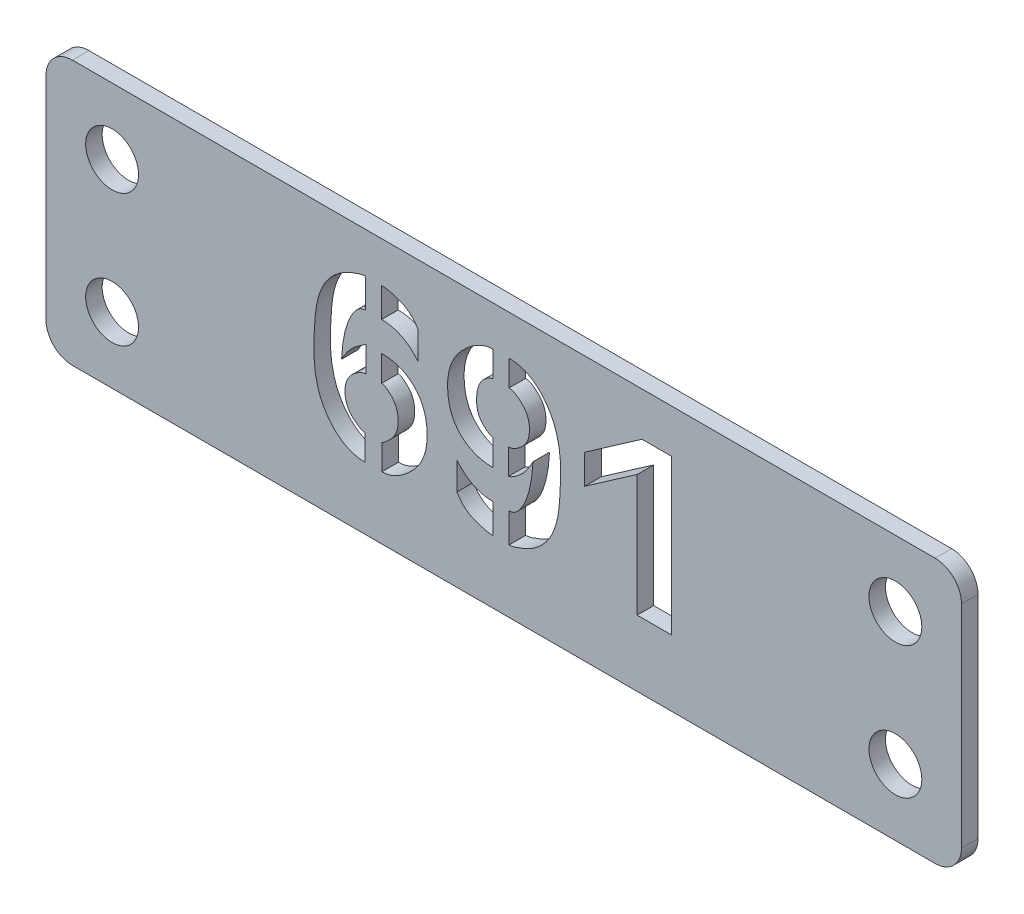
from build123d import *

# Parameters (mm, degrees)
SKETCH1_W           = 87.95004
SKETCH1_H           = 25.4
BOSS_EXTRUDE1_DEPTH = 1.5875
FILLET1_R           = 2.54
SKETCH2_R           = 2.54
CUT_EXTRUDE1_DEPTH  = 2.54
CUT_EXTRUDE2_DEPTH  = 2.54


with BuildPart() as part:
    # Sketch1 → Boss-Extrude1 (new body)
    with BuildSketch(Plane.XY):
        with Locations((-43.97502, 12.7)):
            Rectangle(SKETCH1_W, SKETCH1_H)
    extrude(amount=BOSS_EXTRUDE1_DEPTH)

    # Fillet1
    fillet1_edges = [part.edges().sort_by_distance(p)[0] for p in [
        (0, 0, 0.79375),
        (-87.95004, 0, 0.79375),
        (-87.95004, 25.4, 0.79375),
        (0, 25.4, 0.79375),
    ]]
    fillet(fillet1_edges, radius=FILLET1_R)

    # Sketch2 → Cut-Extrude1 (cut)
    with BuildSketch(Plane.XY.offset(1.5875)):
        with Locations((-81.60004, 19.05)):
            Circle(SKETCH2_R)
        with Locations((-81.60004, 6.35)):
            Circle(SKETCH2_R)
        with Locations((-6.35, 19.05)):
            Circle(SKETCH2_R)
        with Locations((-6.35, 6.35)):
            Circle(SKETCH2_R)
    extrude(amount=-CUT_EXTRUDE1_DEPTH, mode=Mode.SUBTRACT)

    # Sketch4 → Cut-Extrude2 (cut)
    with BuildSketch(Plane.XY.offset(1.5875)):
        with BuildLine():
            add(Edge.make_bspline(
                [(-55.699699688, 18.674457031), (-55.53493294, 18.669656693), (-55.209983722, 18.660189575), (-54.732814797, 18.580306443), (-54.274165116, 18.450738844), (-53.832340648, 18.268695893), (-53.403942671, 18.031191272), (-52.993168225, 17.725918526), (-52.591601689, 17.362229839), (-52.34858237, 17.081039648), (-52.223570781, 16.936392578)],
                knots=[0, 0, 0, 0, 0.981589237, 1.935867881, 2.874883326, 3.817193382, 4.778009358, 5.786515652, 6.86136133, 8, 8, 8, 8], degree=3))
            Line((-52.223570781, 16.936392578), (-52.223570781, 19.612818359))
            add(Edge.make_bspline(
                [(-52.223570781, 19.612818359), (-52.278151636, 19.700734095), (-52.386149226, 19.874690467), (-52.568712135, 20.117232517), (-52.772725397, 20.331879114), (-52.97931924, 20.535510444), (-53.208822964, 20.709400266), (-53.449871809, 20.864454926), (-53.705548986, 20.997797903), (-54.055341165, 21.136460418), (-54.472080766, 21.277277144), (-54.933452543, 21.405336292), (-55.335744385, 21.486294875), (-55.585477869, 21.499585338), (-55.699699688, 21.505664062)],
                knots=[0, 0, 0, 0, 0.90278196, 1.786309056, 2.642480722, 3.484980933, 4.31416784, 5.149327231, 5.984117888, 6.825364222, 8.429954301, 9.820147594, 11.002990303, 12, 12, 12, 12], degree=3))
            Line((-55.699699688, 21.505664062), (-55.699699688, 18.674457031))
        make_face()
        with BuildLine():
            add(Edge.make_bspline(
                [(-55.699699688, 13.369974609), (-55.637397721, 13.360303427), (-55.491854502, 13.337710642), (-55.26891411, 13.20695491), (-55.016197388, 13.004484474), (-54.783458026, 12.791787539), (-54.597854493, 12.581928987), (-54.465190979, 12.404563427), (-54.362039563, 12.205436897), (-54.268597358, 11.995834369), (-54.202490521, 11.767753844), (-54.154042963, 11.525038649), (-54.12546483, 11.266081866), (-54.117084965, 10.996716415), (-54.123801531, 10.725697804), (-54.161080949, 10.463806828), (-54.215683582, 10.21470071), (-54.288437105, 9.976707666), (-54.38992038, 9.753602211), (-54.512182757, 9.544059328), (-54.656422465, 9.347798007), (-54.817726954, 9.168960059), (-54.983499084, 9.011033463), (-55.130954159, 8.867032188), (-55.264693999, 8.748250968), (-55.377954536, 8.646972467), (-55.479263892, 8.572959671), (-55.560454542, 8.51843939), (-55.62288812, 8.476508105), (-55.663896839, 8.470841961), (-55.680352031, 8.468568359)],
                knots=[0, 0, 0, 0, 0.84864035, 1.982503222, 3.436639188, 5.250824462, 6.241735261, 7.232538953, 8.242964425, 9.274079802, 10.338818494, 11.453137866, 12.626015645, 13.865157423, 15.104299202, 16.295225768, 17.444059308, 18.559140348, 19.661201451, 20.758146762, 21.842148025, 22.956467397, 24.017611687, 24.945010351, 25.749613388, 26.441759091, 27.004132635, 27.444590983, 27.777136126, 28, 28, 28, 28], degree=3))
            Line((-55.680352031, 8.468568359), (-55.680352031, 6.014640625))
            add(Edge.make_bspline(
                [(-55.680352031, 6.014640625), (-55.566063441, 6.018908891), (-55.333196752, 6.027605621), (-54.984550314, 6.102753848), (-54.632642107, 6.220822359), (-54.27593451, 6.383803985), (-53.915741436, 6.594002658), (-53.553398265, 6.85247371), (-53.184981037, 7.152868477), (-52.8196198, 7.496501275), (-52.472122067, 7.872107904), (-52.164940176, 8.277874664), (-51.911043078, 8.708883613), (-51.698614745, 9.160636182), (-51.53421151, 9.635102213), (-51.418247128, 10.133423631), (-51.347008838, 10.652640019), (-51.326832066, 11.185863094), (-51.3466164, 11.713776412), (-51.398980217, 12.220963475), (-51.492773136, 12.69801541), (-51.623651854, 13.144780882), (-51.796605208, 13.559784581), (-52.001775749, 13.946635721), (-52.250025189, 14.29949871), (-52.529464662, 14.623315862), (-52.843964125, 14.908299172), (-53.178879411, 15.163918944), (-53.544078478, 15.371934835), (-53.928010052, 15.549020128), (-54.339108027, 15.679878649), (-54.771621033, 15.776750107), (-55.228354804, 15.835906154), (-55.540442512, 15.842903758), (-55.699699688, 15.846474609)],
                knots=[0, 0, 0, 0, 0.750466217, 1.529099129, 2.333333938, 3.186938629, 4.101755041, 5.070001607, 6.109345241, 7.223855547, 8.363888835, 9.468774831, 10.561602582, 11.645626676, 12.744829309, 13.855212284, 15.00316355, 16.18396811, 17.357438015, 18.473044873, 19.531539208, 20.548554855, 21.527259833, 22.4818019, 23.420527851, 24.35691164, 25.28690457, 26.205287319, 27.120103732, 28.043283237, 28.979347187, 29.949421824, 30.953597721, 32, 32, 32, 32], degree=3))
            Line((-55.699699688, 15.846474609), (-55.699699688, 13.369974609))
        make_face()
        with BuildLine():
            Line((-57.282982891, 5.992068359), (-57.282982891, 8.445996094))
            add(Edge.make_bspline(
                [(-57.282982891, 8.445996094), (-57.371375873, 8.458755243), (-57.56512769, 8.486722489), (-57.855060447, 8.639402377), (-58.17379116, 8.857482734), (-58.450720009, 9.093877134), (-58.67224193, 9.317653797), (-58.8173321, 9.511428142), (-58.945202988, 9.715100875), (-59.048114503, 9.933812883), (-59.125030897, 10.167055637), (-59.184963822, 10.411509404), (-59.213981991, 10.671284515), (-59.229417967, 10.938621571), (-59.213963674, 11.205944244), (-59.185032668, 11.465760308), (-59.12478562, 11.710071715), (-59.04959051, 11.941973018), (-58.944189609, 12.156398536), (-58.817286633, 12.356144062), (-58.673049169, 12.546607139), (-58.448080633, 12.764035889), (-58.166053942, 12.997272117), (-57.829598357, 13.211495222), (-57.509235028, 13.352396668), (-57.295907211, 13.379733733), (-57.195918437, 13.392546875)],
                knots=[0, 0, 0, 0, 0.927388831, 2.032777548, 3.375484782, 4.969034164, 5.826957393, 6.660414622, 7.49265999, 8.336796255, 9.17861274, 10.055876385, 10.961446106, 11.906020874, 12.850595642, 13.756165363, 14.633429008, 15.475245493, 16.299111061, 17.121827315, 17.946381701, 18.788273118, 20.384670103, 21.762208047, 22.95112567, 24, 24, 24, 24], degree=3))
            Line((-57.195918437, 13.392546875), (-57.195918437, 15.846474609))
            add(Edge.make_bspline(
                [(-57.195918437, 15.846474609), (-57.205731837, 15.843567243), (-57.234534722, 15.835033956), (-57.28409521, 15.802121934), (-57.361084077, 15.758064239), (-57.457992092, 15.68915742), (-57.582267148, 15.605351346), (-57.729916431, 15.502646972), (-57.900441155, 15.379572306), (-58.163760379, 15.189564882), (-58.50302387, 14.904880698), (-58.884433638, 14.488084732), (-59.23961156, 13.993363718), (-59.447928851, 13.627880618), (-59.5563325, 13.437691406)],
                knots=[0, 0, 0, 0, 0.107227588, 0.314719051, 0.619055722, 1.042269004, 1.562688087, 2.196047321, 2.93315846, 3.77413392, 5.610653111, 7.578375929, 9.699085951, 12, 12, 12, 12], degree=3))
            add(Edge.make_bspline(
                [(-59.5563325, 13.437691406), (-59.546089395, 13.628059216), (-59.526035721, 14.000756173), (-59.470026814, 14.544869768), (-59.399593473, 15.061186663), (-59.314231526, 15.549189574), (-59.206318089, 16.008123093), (-59.086219709, 16.440878202), (-58.942616881, 16.844859128), (-58.788075557, 17.219766348), (-58.617387176, 17.555683816), (-58.444175891, 17.853243139), (-58.262114021, 18.104536217), (-58.074128106, 18.310403637), (-57.882360469, 18.47430684), (-57.680734239, 18.587761744), (-57.472853259, 18.661451313), (-57.330854173, 18.670144484), (-57.260410625, 18.674457031)],
                knots=[0, 0, 0, 0, 1.499814804, 2.936296909, 4.302182762, 5.59947636, 6.832403556, 8.010357135, 9.131089549, 10.20385637, 11.198577165, 12.09348467, 12.910514558, 13.634730622, 14.283349854, 14.885477346, 15.447102571, 16, 16, 16, 16], degree=3))
            Line((-57.260410625, 18.674457031), (-57.237838359, 21.505664062))
            add(Edge.make_bspline(
                [(-57.237838359, 21.505664062), (-57.281985901, 21.504429036), (-57.377239047, 21.501764331), (-57.529180973, 21.476851836), (-57.700384968, 21.438090506), (-57.890948797, 21.38097637), (-58.102762101, 21.315336906), (-58.333178095, 21.229082276), (-58.583110973, 21.130311572), (-58.939198352, 20.97625848), (-59.382850544, 20.752250743), (-59.884237997, 20.423254749), (-60.336544022, 20.027164557), (-60.752375612, 19.581794377), (-61.120098096, 19.076012804), (-61.426644481, 18.504044272), (-61.680094709, 17.873357188), (-61.846867214, 17.300714633), (-61.951378243, 16.796155437), (-62.022406221, 16.363817427), (-62.078550828, 15.882665504), (-62.12646362, 15.353635044), (-62.165644875, 14.775262202), (-62.189828772, 14.148339338), (-62.20493209, 13.473250257), (-62.215319585, 12.764718145), (-62.195312778, 12.047720291), (-62.134001317, 11.351070272), (-62.01930226, 10.68976481), (-61.864748424, 10.062451827), (-61.670463688, 9.466120609), (-61.423038099, 8.907458072), (-61.136531025, 8.381312837), (-60.804504862, 7.897342173), (-60.443530069, 7.456445583), (-60.05536316, 7.070973789), (-59.647171868, 6.740994185), (-59.215865485, 6.472337731), (-58.764476752, 6.258417189), (-58.288473496, 6.112012378), (-57.793155294, 6.014330141), (-57.454350663, 5.999546129), (-57.282982891, 5.992068359)],
                knots=[0, 0, 0, 0, 0.258224805, 0.557148246, 0.898993637, 1.285243804, 1.720939094, 2.19658318, 2.72458875, 3.293713335, 4.466905185, 5.628895522, 6.792944422, 7.976997915, 9.188751248, 10.441371996, 11.764900031, 13.160426009, 13.925358936, 14.779596104, 15.723723076, 16.759701844, 17.888262126, 19.115977772, 20.431107321, 21.840277142, 23.26265396, 24.627254405, 25.929304834, 27.186498069, 28.405934197, 29.594607541, 30.757363885, 31.907200789, 33.024360023, 34.08748595, 35.103329479, 36.089543733, 37.054830995, 38.01777866, 38.997390164, 40, 40, 40, 40], degree=3))
        make_face()
        with BuildLine():
            Line((-45.000445781, 6.037212891), (-45.000445781, 8.868419922))
            add(Edge.make_bspline(
                [(-45.000445781, 8.868419922), (-45.165209732, 8.873225378), (-45.490153433, 8.882702589), (-45.967362638, 8.962512027), (-46.425862338, 9.092354027), (-46.868739038, 9.273564263), (-47.295367579, 9.515416853), (-47.706032976, 9.82004497), (-48.109579653, 10.180604339), (-48.351754662, 10.461636756), (-48.476574688, 10.606484375)],
                knots=[0, 0, 0, 0, 0.981732815, 1.936151043, 2.87530384, 3.817751729, 4.781843651, 5.79049746, 6.86119478, 8, 8, 8, 8], degree=3))
            Line((-48.476574688, 10.606484375), (-48.476574688, 7.933283203))
            add(Edge.make_bspline(
                [(-48.476574688, 7.933283203), (-48.422139653, 7.845227855), (-48.314430595, 7.670995235), (-48.129717813, 7.430414208), (-47.933311598, 7.208319511), (-47.718535624, 7.01352587), (-47.495779998, 6.831738326), (-47.253230417, 6.678606158), (-46.997135124, 6.545798023), (-46.649701507, 6.400958531), (-46.230389162, 6.267127949), (-45.769056188, 6.136712656), (-45.365401654, 6.056893121), (-45.114650057, 6.043371352), (-45.000445781, 6.037212891)],
                knots=[0, 0, 0, 0, 0.902084857, 1.784929717, 2.641056041, 3.483322918, 4.310277924, 5.144792429, 5.978938483, 6.823132329, 8.423495102, 9.812614926, 11.003760167, 12, 12, 12, 12], degree=3))
        make_face()
        with BuildLine():
            Line((-45.000445781, 11.699626953), (-45.000445781, 14.172902344))
            add(Edge.make_bspline(
                [(-45.000445781, 14.172902344), (-45.072658737, 14.194735966), (-45.232407262, 14.243036009), (-45.466011234, 14.393227656), (-45.727529412, 14.590240665), (-45.955536034, 14.795560231), (-46.136312763, 14.99222897), (-46.255082474, 15.165952023), (-46.360244027, 15.35233157), (-46.439989818, 15.559426106), (-46.50358109, 15.781847774), (-46.553721615, 16.020815296), (-46.576783008, 16.27809432), (-46.589678518, 16.632323241), (-46.566530417, 17.060193384), (-46.48559312, 17.533604554), (-46.349379753, 17.946213284), (-46.153177826, 18.295367051), (-45.909950422, 18.57848864), (-45.646368946, 18.817052618), (-45.346279194, 18.991677247), (-45.130900771, 19.063919456), (-45.023018047, 19.100105469)],
                knots=[0, 0, 0, 0, 0.715951478, 1.583818193, 2.622518131, 3.840770963, 4.500905221, 5.163023417, 5.84157773, 6.535877148, 7.271776186, 8.045216538, 8.858597215, 9.729842735, 11.422544117, 12.931550855, 14.295331202, 15.543029889, 16.72081764, 17.838634662, 18.917375397, 20, 20, 20, 20], degree=3))
            Line((-45.023018047, 19.100105469), (-45.023018047, 21.550808594))
            add(Edge.make_bspline(
                [(-45.023018047, 21.550808594), (-45.137314517, 21.546557564), (-45.370197262, 21.537895953), (-45.71871844, 21.462473741), (-46.071557977, 21.345368354), (-46.426579561, 21.177607945), (-46.78767844, 20.968414033), (-47.150868907, 20.709755189), (-47.51841194, 20.405976017), (-47.882646703, 20.059255372), (-48.232546393, 19.683588184), (-48.537260295, 19.274899339), (-48.793427459, 18.843151122), (-49.003846157, 18.389339991), (-49.169872987, 17.913355736), (-49.284633219, 17.413626525), (-49.356620625, 16.892421048), (-49.376476051, 16.358078491), (-49.356779524, 15.829102808), (-49.304383311, 15.321913135), (-49.210599107, 14.844860872), (-49.079715844, 14.398098908), (-48.906771975, 13.983082199), (-48.701569032, 13.596277979), (-48.453437454, 13.243243639), (-48.173561722, 12.920060916), (-47.860507614, 12.632584839), (-47.519776963, 12.385698786), (-47.16030034, 12.166995875), (-46.770979353, 12.000398958), (-46.362452628, 11.860418737), (-45.927863125, 11.770941958), (-45.471905579, 11.709764067), (-45.159741784, 11.703052063), (-45.000445781, 11.699626953)],
                knots=[0, 0, 0, 0, 0.749494808, 1.527119852, 2.330313653, 3.185757064, 4.099389332, 5.066382591, 6.108855094, 7.226764498, 8.365322118, 9.4744249, 10.565838086, 11.65485419, 12.752634007, 13.868448651, 15.014914, 16.201239304, 17.37319026, 18.487353069, 19.544477281, 20.560176496, 21.53761463, 22.490921131, 23.428431988, 24.363603715, 25.292392855, 26.211051014, 27.122173597, 28.047714602, 28.984774037, 29.952076108, 30.954952192, 32, 32, 32, 32], degree=3))
        make_face()
        with BuildLine():
            add(Edge.make_bspline(
                [(-43.530023906, 11.699626953), (-43.445243535, 11.73084044), (-43.26372745, 11.797668999), (-42.996532779, 11.949523705), (-42.712934434, 12.14367947), (-42.408925167, 12.382297142), (-42.096104576, 12.692877636), (-41.785291358, 13.087903), (-41.469418048, 13.56470632), (-41.27145374, 13.917788863), (-41.166385234, 14.105185547)],
                knots=[0, 0, 0, 0, 0.627367658, 1.343203847, 2.128914725, 3.017247848, 4.026746978, 5.185895718, 6.506429098, 8, 8, 8, 8], degree=3))
            add(Edge.make_bspline(
                [(-41.166385234, 14.105185547), (-41.17669007, 13.914827707), (-41.196806786, 13.543218245), (-41.251786793, 12.999875674), (-41.327208139, 12.485166156), (-41.412249305, 11.996005285), (-41.518090281, 11.535097133), (-41.643927654, 11.102590981), (-41.786258309, 10.697924295), (-41.941236482, 10.323186365), (-42.111501711, 9.987000946), (-42.285517847, 9.690780865), (-42.463589972, 9.437422326), (-42.651882101, 9.232428808), (-42.843115365, 9.069659191), (-43.042593414, 8.954296251), (-43.249931596, 8.881546249), (-43.391885818, 8.872772462), (-43.462307109, 8.868419922)],
                knots=[0, 0, 0, 0, 1.500656453, 2.929525446, 4.297356154, 5.595377752, 6.837240619, 8.018191915, 9.139553248, 10.212922072, 11.208201073, 12.103610771, 12.916135179, 13.64075765, 14.289740866, 14.884851911, 15.446792303, 16, 16, 16, 16], degree=3))
            Line((-43.462307109, 8.868419922), (-43.462307109, 6.037212891))
            add(Edge.make_bspline(
                [(-43.462307109, 6.037212891), (-43.420255419, 6.038177115), (-43.327925868, 6.040294186), (-43.18144882, 6.071497032), (-43.012073291, 6.103198055), (-42.826383697, 6.162075116), (-42.617472821, 6.227829857), (-42.391795781, 6.317959337), (-42.141124923, 6.412060175), (-41.786375956, 6.568060561), (-41.33931537, 6.787454503), (-40.843595648, 7.126047466), (-40.384928982, 7.512949763), (-39.973044062, 7.963005531), (-39.606584153, 8.469461269), (-39.299203559, 9.04201618), (-39.045875579, 9.672756551), (-38.879071176, 10.245385225), (-38.774565078, 10.749946512), (-38.7035354, 11.182283997), (-38.647393546, 11.663436175), (-38.599470369, 12.192466167), (-38.560405343, 12.769769162), (-38.536031089, 13.395608711), (-38.521023476, 14.069628189), (-38.510636112, 14.778155468), (-38.530563156, 15.495168328), (-38.592270582, 16.192822406), (-38.706213662, 16.855339329), (-38.861266807, 17.483627115), (-39.055356782, 18.080038532), (-39.303689952, 18.639305142), (-39.589312489, 19.167945247), (-39.921336597, 19.655236173), (-40.28270868, 20.098781042), (-40.669486368, 20.489520045), (-41.082989629, 20.816033469), (-41.513319331, 21.092737088), (-41.97137314, 21.301782203), (-42.448650697, 21.454190497), (-42.947899099, 21.551296955), (-43.288812563, 21.565932614), (-43.462307109, 21.573380859)],
                knots=[0, 0, 0, 0, 0.245559707, 0.539155907, 0.873375119, 1.253430618, 1.676982459, 2.154632799, 2.674270605, 3.243164832, 4.421482356, 5.581264913, 6.745522095, 7.924829133, 9.141190085, 10.393303821, 11.716296145, 13.111257269, 13.875880582, 14.729771988, 15.673516815, 16.709076259, 17.837179745, 19.058115633, 20.37271287, 21.781312315, 23.203113411, 24.567161521, 25.874882949, 27.131567323, 28.350509871, 29.538702087, 30.706502923, 31.86107456, 32.982639687, 34.049772387, 35.070118734, 36.059277293, 37.035580601, 38.006034322, 38.985249318, 40, 40, 40, 40], degree=3))
            Line((-43.462307109, 21.573380859), (-43.462307109, 19.100105469))
            add(Edge.make_bspline(
                [(-43.462307109, 19.100105469), (-43.370658855, 19.091244413), (-43.17139418, 19.071978412), (-42.874175157, 18.920441288), (-42.550822943, 18.70247907), (-42.275063335, 18.459516807), (-42.054732407, 18.231837026), (-41.907424671, 18.037576628), (-41.781807091, 17.831434028), (-41.676907012, 17.611570623), (-41.601622057, 17.376649677), (-41.540495738, 17.130385815), (-41.512238782, 16.869401117), (-41.496442398, 16.601034378), (-41.512084136, 16.333726796), (-41.540472612, 16.074859719), (-41.601709181, 15.831862632), (-41.676293372, 15.600891032), (-41.781765268, 15.386478216), (-41.908663416, 15.186746475), (-42.052849317, 14.996215057), (-42.277499104, 14.779708154), (-42.556904644, 14.544587707), (-42.893219771, 14.331527856), (-43.214436174, 14.189944426), (-43.428928479, 14.163020145), (-43.530023906, 14.150330078)],
                knots=[0, 0, 0, 0, 0.950856217, 2.067383125, 3.413910326, 5.015579641, 5.878104964, 6.708173646, 7.546567598, 8.387271898, 9.236270875, 10.10996787, 11.022957074, 11.963691529, 12.904425985, 13.806313974, 14.669129416, 15.507523368, 16.328039384, 17.14741076, 17.968612795, 18.807081373, 20.388345924, 21.760283277, 22.944367174, 24, 24, 24, 24], degree=3))
            Line((-43.530023906, 14.150330078), (-43.530023906, 11.699626953))
        make_face()
        Polygon((-27.880994609, 21.215449219), (-27.880994609, 6.35), (-31.157197734, 6.35), (-31.157197734, 18.052107422), (-36.194037578, 14.55340625), (-36.194037578, 17.381388672), (-30.689629375, 21.215449219), align=None)
    extrude(amount=-CUT_EXTRUDE2_DEPTH, mode=Mode.SUBTRACT)


solid = part.part
